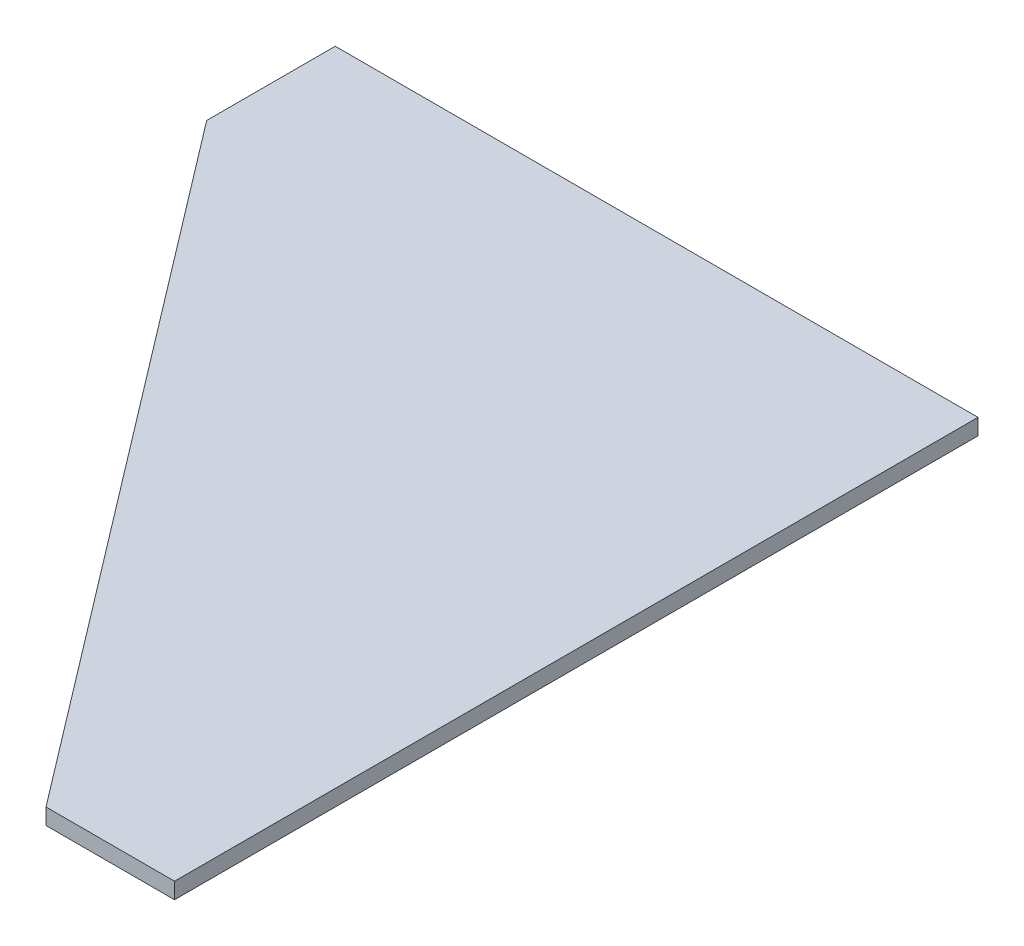
from build123d import *

# Parameters (mm, degrees)
SKETCH1_W           = 101.6
SKETCH1_H           = 25.4
SKETCH1_W_2         = 25.4
SKETCH1_H_2         = 158.75
BOSS_EXTRUDE1_DEPTH = 3.175


with BuildPart() as part:
    # Sketch1 → Boss-Extrude1 (new body)
    with BuildSketch(Plane(origin=(0, 0, 0), x_dir=(1, 0, 0), z_dir=(0, 1, 0))):
        with Locations((-63.5, 66.675)):
            Rectangle(SKETCH1_W, SKETCH1_H)
        Polygon((-12.7, -79.375), (-12.7, 53.975), (-114.3, 53.975), align=None)
        Rectangle(SKETCH1_W_2, SKETCH1_H_2)
    extrude(amount=BOSS_EXTRUDE1_DEPTH)


solid = part.part
